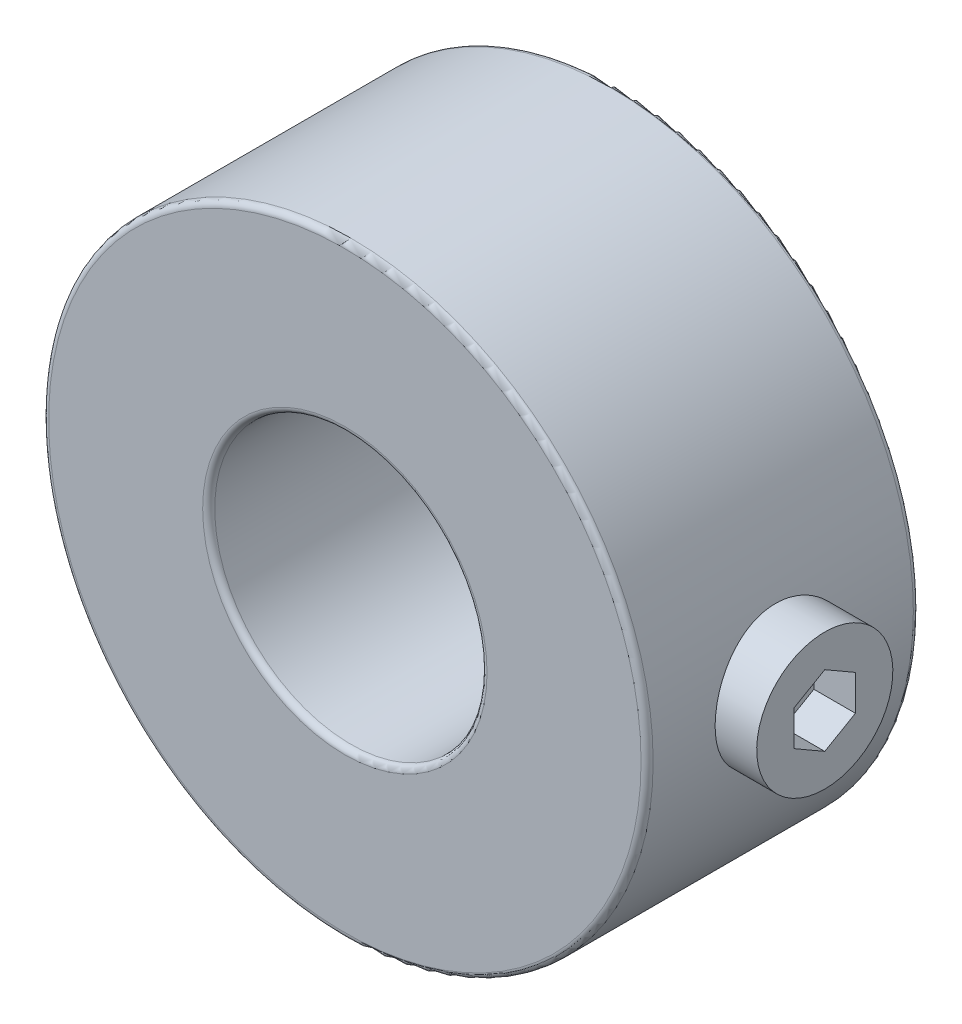
from build123d import *

# Parameters (mm, degrees)
SKETCH1_R               = 11.1
SKETCH1_R_2             = 5
EXTRUDE1_DEPTH          = 10
CUT_EXTRUDE1_REACH      = 28.759
CUT_EXTRUDE1_END_RADIUS = 5
SKETCH2_R               = 2.5
SKETCH3_W               = 6.1
SKETCH3_H               = 2.5
CUT_EXTRUDE2_DEPTH      = 1.525
FILLET1_R               = 0.222


with BuildPart() as part:
    # Sketch1 → Extrude1 (new body)
    with BuildSketch(Plane.XY):
        Circle(SKETCH1_R)
        Circle(SKETCH1_R_2, mode=Mode.SUBTRACT)
    extrude(amount=EXTRUDE1_DEPTH)

    # Cut-Extrude1: up to this cylinder (the profile starts outside it)
    cut_extrude1_end = Plane(origin=(0, 0, 5), z_dir=(0, 0, -1)) * Cylinder(CUT_EXTRUDE1_END_RADIUS, 68.518, mode=Mode.PRIVATE)
    # Sketch2 → Cut-Extrude1 (cut, up to the surface)
    with BuildSketch(Plane(origin=(11.1, 0, 0), x_dir=(0, 0, -1), z_dir=(1, 0, 0)), mode=Mode.PRIVATE) as cut_extrude1_sk1:
        with Locations((-5, 0)):
            Circle(SKETCH2_R)
    cut_extrude1_tool1 = extrude(cut_extrude1_sk1.sketch, amount=-CUT_EXTRUDE1_REACH, mode=Mode.PRIVATE) - cut_extrude1_end
    add(cut_extrude1_tool1.solids().sort_by_distance((11.1, 0, 5))[0], mode=Mode.SUBTRACT)

    # Fillet1
    fillet1_edges = [part.edges().sort_by_distance(p)[0] for p in [
        (-11.1, 0, 0),
        (-11.1, 0, 10),
        (-5, 0, 0),
        (-5, 0, 10),
    ]]
    fillet(fillet1_edges, radius=FILLET1_R)


with BuildPart() as body_2:
    # Sketch3 → Revolve1 (revolve)
    with BuildSketch(Plane.XY.offset(5), mode=Mode.PRIVATE) as revolve1_sk:
        with Locations((9.575, 1.25)):
            Rectangle(SKETCH3_W, SKETCH3_H)
    revolve(revolve1_sk.sketch.rotate(Axis((6.525, 0, 5), (1, 0, 0)), 180), axis=Axis((6.525, 0, 5), (1, 0, 0)))

    # Sketch4 → Cut-Extrude2 (cut)
    with BuildSketch(Plane(origin=(12.625, 0, 0), x_dir=(0, 0, -1), z_dir=(1, 0, 0))):
        Polygon((-5, 1.299038106), (-6.125, 0.649519053), (-6.125, -0.649519053), (-5, -1.299038106), (-3.875, -0.649519053), (-3.875, 0.649519053), align=None)
    extrude(amount=-CUT_EXTRUDE2_DEPTH, mode=Mode.SUBTRACT)


solid = Compound([part.part, body_2.part])
